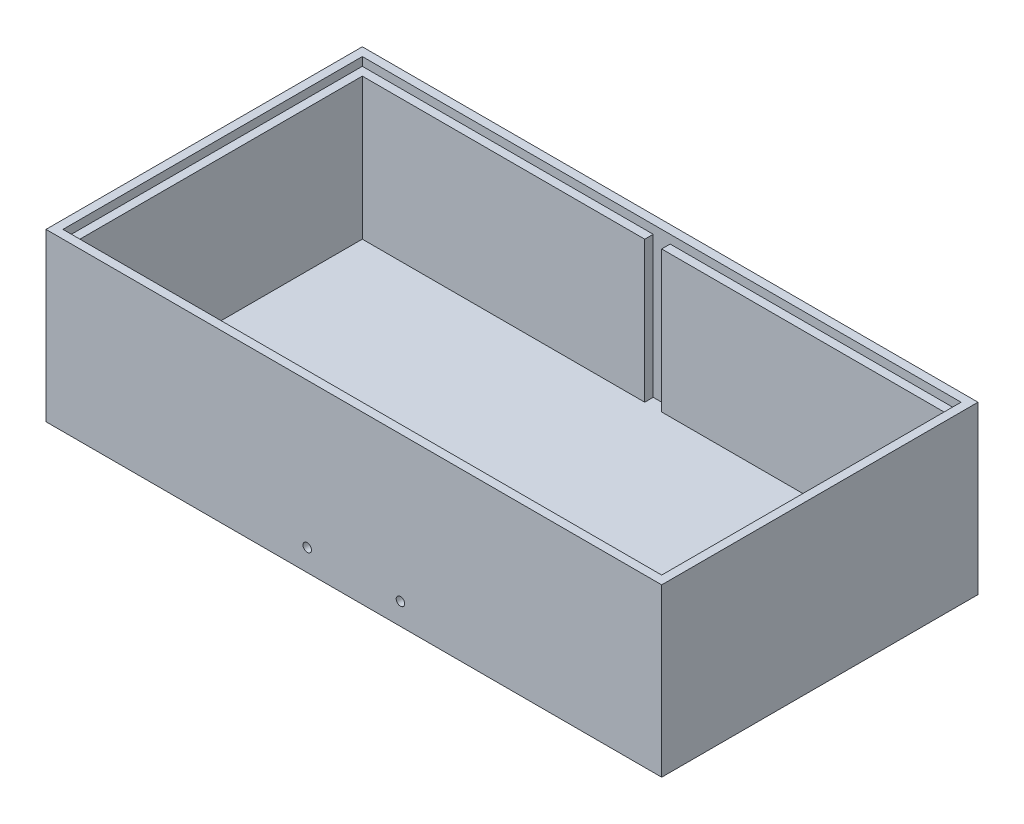
from build123d import *

# Parameters (mm, degrees)
SKETCH1_W           = 109
SKETCH1_H           = 112
BOSS_EXTRUDE1_DEPTH = 59
CUT_EXTRUDE1_DEPTH  = 53
CUT_EXTRUDE2_DEPTH  = 3
SKETCH6_R           = 1.5
CUT_EXTRUDE28_DEPTH = 6


with BuildPart() as part:
    # Sketch1 → Boss-Extrude1 (new body)
    with BuildSketch(Plane(origin=(0, 0, 0), x_dir=(1, 0, 0), z_dir=(0, 1, 0))):
        with Locations((-54.5, 0)):
            Rectangle(SKETCH1_W, SKETCH1_H)
    boss_extrude1 = extrude(amount=BOSS_EXTRUDE1_DEPTH)

    # Sketch2 → Cut-Extrude1 (cut)
    with BuildSketch(Plane(origin=(0, 59, 0), x_dir=(1, 0, 0), z_dir=(0, 1, 0))):
        Polygon((-103, 50), (-103, -50), (-3, -50), (-3, -53), (0, -53), (0, 53), (-3, 53), (-3, 50), align=None)
    cut_extrude1 = extrude(amount=-CUT_EXTRUDE1_DEPTH, mode=Mode.SUBTRACT)

    # Sketch2<3> → Cut-Extrude2 (cut)
    with BuildSketch(Plane(origin=(0, 59, 0), x_dir=(1, 0, 0), z_dir=(0, 1, 0))):
        Polygon((-106, 53), (-106, -53), (-3, -53), (-3, 0), (-6, 0), (-6, -50), (-103, -50), (-103, 50), (-3, 50), (-3, 53), align=None)
    cut_extrude2 = extrude(amount=-CUT_EXTRUDE2_DEPTH, mode=Mode.SUBTRACT)

    # Sketch6 → Cut-Extrude28 (cut)
    with BuildSketch(Plane.XY.offset(56)):
        with Locations((-16.5, 7.7)):
            Circle(SKETCH6_R)
    cut_extrude28 = extrude(amount=-CUT_EXTRUDE28_DEPTH, mode=Mode.SUBTRACT)

    # Mirror1: Boss-Extrude1, Cut-Extrude1, Cut-Extrude2, Cut-Extrude28 across plane
    add(boss_extrude1.mirror(Plane(origin=(0, 0, 0), x_dir=(0, 0, 1), z_dir=(1, 0, 0))))
    add(cut_extrude1.mirror(Plane(origin=(0, 0, 0), x_dir=(0, 0, 1), z_dir=(1, 0, 0))), mode=Mode.SUBTRACT)
    add(cut_extrude2.mirror(Plane(origin=(0, 0, 0), x_dir=(0, 0, 1), z_dir=(1, 0, 0))), mode=Mode.SUBTRACT)
    add(cut_extrude28.mirror(Plane(origin=(0, 0, 0), x_dir=(0, 0, 1), z_dir=(1, 0, 0))), mode=Mode.SUBTRACT)


solid = part.part
